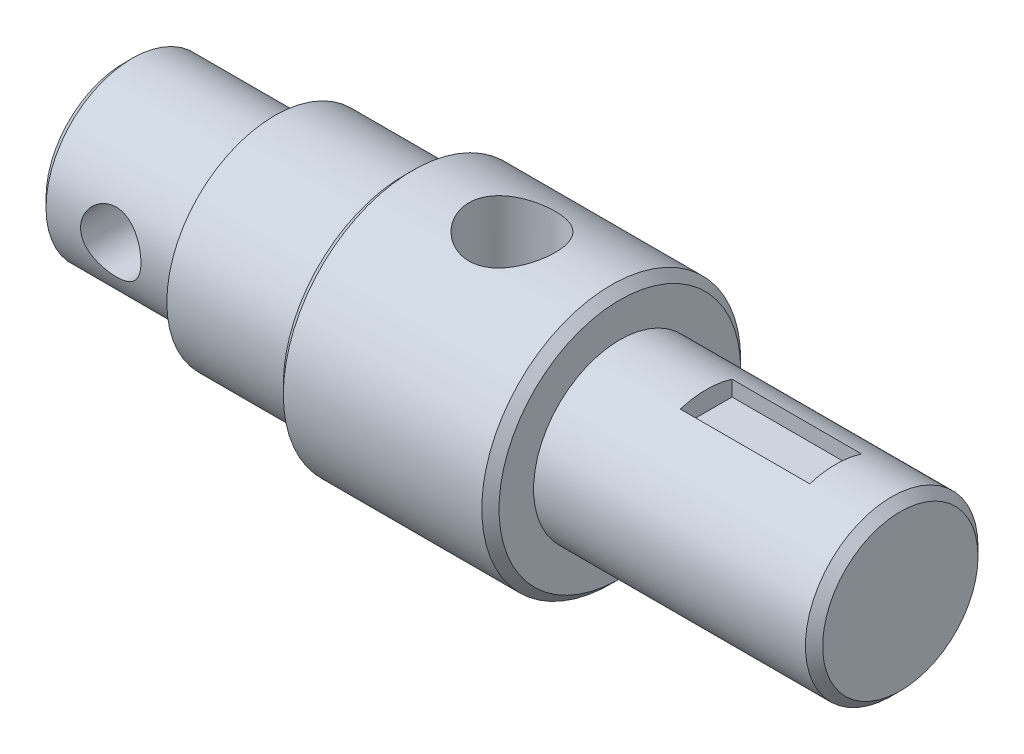
from build123d import *

# Parameters (mm, degrees)
SKETCH_2_W               = 30
SKETCH_2_H               = 4.5
CUT_EXTRUDE_1_DEPTH      = 6
CUT_EXTRUDE_2_DEPTH      = 185.932420089
CUT_EXTRUDE_2_DEPTH_BACK = 185.932420089
SKETCH_3_R               = 7
PATTERN_CIRCULAR_1_COUNT = 2
CHAMFER_1_SIZE           = 2


with BuildPart() as part:
    # Эскиз1 → Повернуть1 (revolve)
    with BuildSketch(Plane.XY, mode=Mode.PRIVATE) as revolve_1_sk:
        Polygon((0, 0), (0, 20), (35, 20), (35, 25), (65, 25), (65, 30), (115, 30), (115, 20), (180, 20), (180, 0), align=None)
    revolve(revolve_1_sk.sketch.rotate(Axis((0, 0, 0), (-1, 0, 0)), 90), axis=Axis((0, 0, 0), (-1, 0, 0)))

    # Эскиз2 → Вырез-Вытянуть1 (cut, symmetric)
    with BuildSketch(Plane.XY):
        with Locations((150, 17.75)):
            Rectangle(SKETCH_2_W, SKETCH_2_H)
    extrude(amount=CUT_EXTRUDE_1_DEPTH, both=True, mode=Mode.SUBTRACT)

    # Эскиз3 → Вырез-Вытянуть2 (cut, two sides: drawn at the far end of the back side and taken through both)
    with BuildSketch(Plane.XY.offset(-CUT_EXTRUDE_2_DEPTH_BACK)):
        with Locations((17, 0)):
            Circle(SKETCH_3_R)
    extrude(amount=CUT_EXTRUDE_2_DEPTH + CUT_EXTRUDE_2_DEPTH_BACK, mode=Mode.SUBTRACT)

    # Эскиз4 → Диаметр отверстия Ø16.0 (20)1 (revolve, cut)
    with BuildSketch(Plane(origin=(90, 30, 0), x_dir=(0, 0, 1), z_dir=(1, 0, 0))):
        Polygon((0, 0), (0, 26.00860619), (10, 20), (10, 0), align=None)
    hole_wizard_16_0_20_1 = revolve(axis=Axis((90, 36.35, 0), (0, -1, 0)), mode=Mode.SUBTRACT)

    # Круговой массив1: Диаметр отверстия Ø16.0 (20)1 ×2 about axis
    pattern_circular_1_axis = Axis((0, 0, 0), (1, 0, 0))
    for i in range(1, PATTERN_CIRCULAR_1_COUNT):
        add(hole_wizard_16_0_20_1.rotate(pattern_circular_1_axis, i * 360 / PATTERN_CIRCULAR_1_COUNT), mode=Mode.SUBTRACT)

    # Фаска1
    chamfer_1_edges = [part.edges().sort_by_distance(p)[0] for p in [
        (0, 0, 20),
        (180, 0, 20),
        (115, 0, 30),
        (65, 0, 30),
    ]]
    chamfer(chamfer_1_edges, length=CHAMFER_1_SIZE)


solid = part.part
